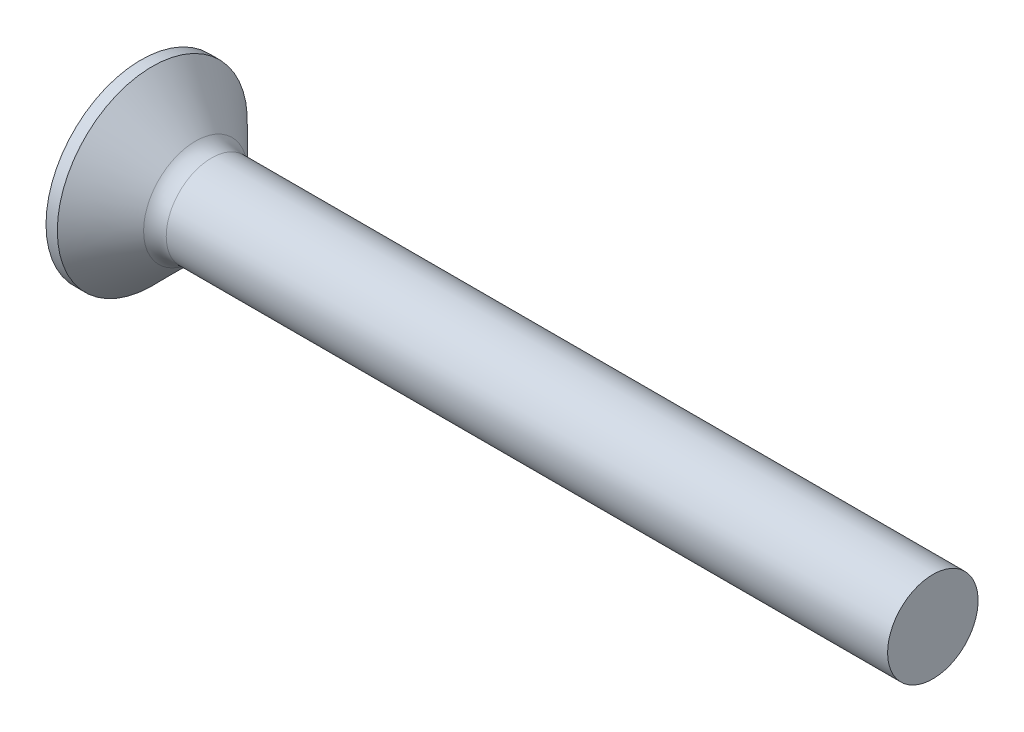
from build123d import *

# Parameters (mm, degrees)
FILLET1_R    = 1
RECPAT_COUNT = 2
RECPAT_ANGLE = 90


with BuildPart() as part:
    # BodySke → Base-Revolve (revolve)
    with BuildSketch(Plane.XY, mode=Mode.PRIVATE) as base_revolve_sk:
        Polygon((0, 0), (0, 4.2), (0.5, 4.2), (2.7, 2), (35, 2), (35, 0), align=None)
    revolve(base_revolve_sk.sketch.rotate(Axis((-6.35, 0, 0), (1, 0, 0)), 90), axis=Axis((-6.35, 0, 0), (1, 0, 0)))

    # Fillet1
    fillet1_edges = [part.edges().sort_by_distance(p)[0] for p in [
        (2.7, 0, -2),
    ]]
    fillet(fillet1_edges, radius=FILLET1_R)

    # Sketch3 → Recess section 0
    with BuildSketch(Plane.ZY):
        with BuildLine():
            Line((-0.515, 2.2), (0.515, 2.2))
            Line((0.515, 2.2), (0.515, -2.2))
            Line((0.515, -2.2), (-0.515, -2.2))
            Line((-0.515, -2.2), (-0.515, 2.2))
        make_face()
    # Sketch4 → Recess section 1
    with BuildSketch(Plane.ZY.offset(-2.51)):
        with BuildLine():
            Line((-0.515, 0.948560373), (0.515, 0.948560373))
            Line((0.515, 0.948560373), (0.515, -0.948560373))
            Line((0.515, -0.948560373), (-0.515, -0.948560373))
            Line((-0.515, -0.948560373), (-0.515, 0.948560373))
        make_face()
    recess = loft(mode=Mode.SUBTRACT)

    # RecPat: Recess ×2 about axis
    recpat_axis = Axis((0, 0, 0), (1, 0, 0))
    for i in range(1, RECPAT_COUNT):
        add(recess.rotate(recpat_axis, i * RECPAT_ANGLE / (RECPAT_COUNT - 1)), mode=Mode.SUBTRACT)

    # RecCorSke → RecessCore (revolve, cut)
    with BuildSketch(Plane.XY, mode=Mode.PRIVATE) as recesscore_sk:
        Polygon((0, 0), (0, 1.026516298), (2.51, 0.851), (2.786506661, 0), align=None)
    revolve(recesscore_sk.sketch.rotate(Axis((-3.175, 0, 0), (1, 0, 0)), 90), axis=Axis((-3.175, 0, 0), (1, 0, 0)), mode=Mode.SUBTRACT)


solid = part.part
